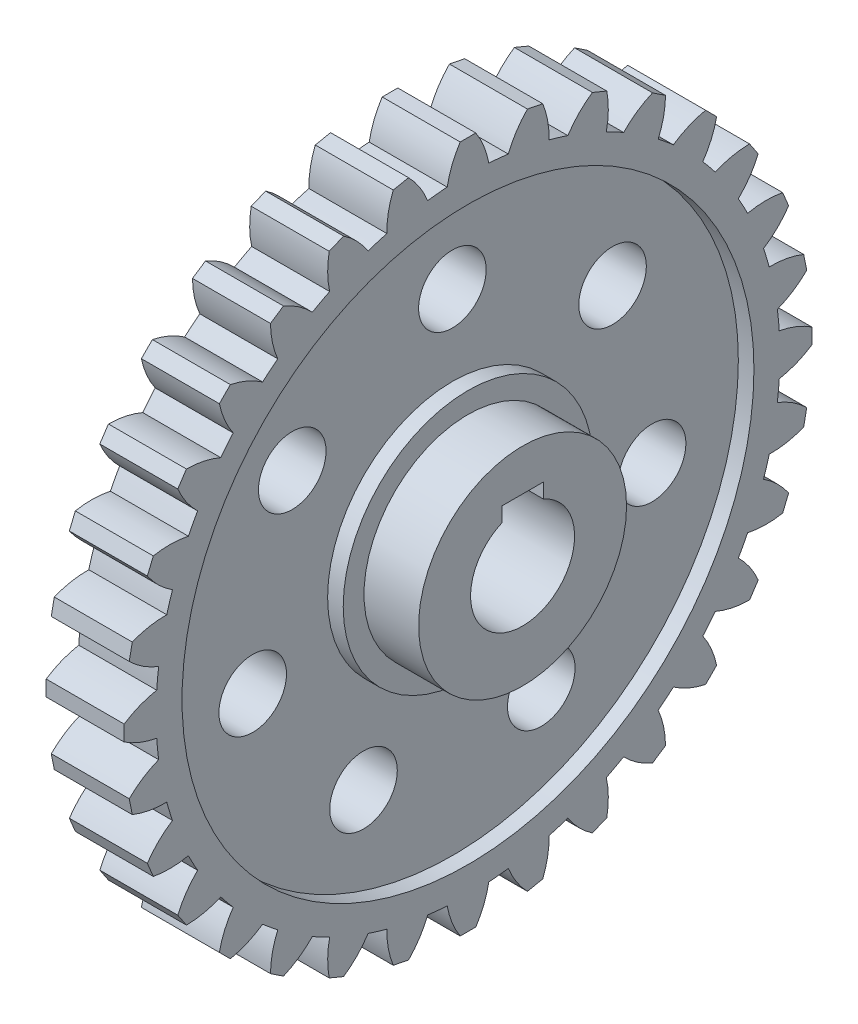
from build123d import *

# Parameters (mm, degrees)
SKETCH1_R               = 60
BOSS_EXTRUDE1_DEPTH     = 7.5
BOSS_EXTRUDE2_DEPTH     = 15
CIRPATTERN1_COUNT       = 32
SKETCH4_R               = 20
BOSS_EXTRUDE3_DEPTH     = 18
CUT_EXTRUDE1_DEPTH      = 101.216188592
CUT_EXTRUDE1_DEPTH_BACK = 101.216188592
SKETCH6_R               = 55
SKETCH6_R_2             = 24
CUT_EXTRUDE2_DEPTH      = 3
SKETCH7_R               = 6.5
CUT_EXTRUDE3_DEPTH      = 97.195293315


with BuildPart() as part:
    # Sketch1 → Boss-Extrude1 (new, symmetric)
    with BuildSketch(Plane(origin=(0, 0, 0), x_dir=(0, 0, -1), z_dir=(1, 0, 0))):
        Circle(SKETCH1_R)
    extrude(amount=BOSS_EXTRUDE1_DEPTH, both=True)

    # Sketch2 → Boss-Extrude2 (add)
    with BuildSketch(Plane(origin=(7.5, 0, 0), x_dir=(0, 0, -1), z_dir=(1, 0, 0))):
        with BuildLine():
            Line((-1.5, 66.133518188), (1.5, 66.133518188))
            ThreePointArc((1.5, 66.133518188), (3.064041848, 63.125294177), (4, 59.866518188))
            ThreePointArc((4, 59.866518188), (0, 60), (-4, 59.866518188))
            ThreePointArc((-4, 59.866518188), (-3.064041848, 63.125294177), (-1.5, 66.133518188))
        make_face()
    boss_extrude2 = extrude(amount=-BOSS_EXTRUDE2_DEPTH)

    # CirPattern1: Boss-Extrude2 ×32 about axis
    cirpattern1_axis = Axis((0, 0, 0), (1, 0, 0))
    for i in range(1, CIRPATTERN1_COUNT):
        add(boss_extrude2.rotate(cirpattern1_axis, i * 360 / CIRPATTERN1_COUNT))

    # Sketch4 → Boss-Extrude3 (add, symmetric)
    with BuildSketch(Plane(origin=(0, 0, 0), x_dir=(0, 0, -1), z_dir=(1, 0, 0))):
        Circle(SKETCH4_R)
    extrude(amount=BOSS_EXTRUDE3_DEPTH, both=True)

    # Sketch5 → Cut-Extrude1 (cut, two sides: drawn at the far end of the back side and taken through both)
    with BuildSketch(Plane(origin=(18, 0, 0), x_dir=(0, 0, -1), z_dir=(1, 0, 0)).offset(-CUT_EXTRUDE1_DEPTH_BACK)):
        with BuildLine():
            Line((-4, 12), (4, 12))
            Line((4, 12), (4, 9.16515139))
            ThreePointArc((4, 9.16515139), (0, -10), (-4, 9.16515139))
            Line((-4, 9.16515139), (-4, 12))
        make_face()
    extrude(amount=CUT_EXTRUDE1_DEPTH + CUT_EXTRUDE1_DEPTH_BACK, mode=Mode.SUBTRACT)

    # Sketch6 → Cut-Extrude2 (cut)
    with BuildSketch(Plane(origin=(7.5, 0, 0), x_dir=(0, 0, -1), z_dir=(1, 0, 0))):
        Circle(SKETCH6_R)
        Circle(SKETCH6_R_2, mode=Mode.SUBTRACT)
    extrude(amount=-CUT_EXTRUDE2_DEPTH, mode=Mode.SUBTRACT)

    # Sketch7 → Cut-Extrude3 (cut, through all)
    with BuildSketch(Plane(origin=(4.5, 0, 0), x_dir=(0, 0, -1), z_dir=(1, 0, 0))):
        with Locations((0, 39.4)):
            Circle(SKETCH7_R)
        with Locations((30.804160409, 24.565498193)):
            Circle(SKETCH7_R)
        with Locations((38.41215974, -8.767324798)):
            Circle(SKETCH7_R)
        with Locations((17.095019321, -35.498173395)):
            Circle(SKETCH7_R)
        with Locations((-17.095019321, -35.498173395)):
            Circle(SKETCH7_R)
        with Locations((-38.41215974, -8.767324798)):
            Circle(SKETCH7_R)
        with Locations((-30.804160409, 24.565498193)):
            Circle(SKETCH7_R)
    extrude(amount=-CUT_EXTRUDE3_DEPTH, mode=Mode.SUBTRACT)


solid = part.part
